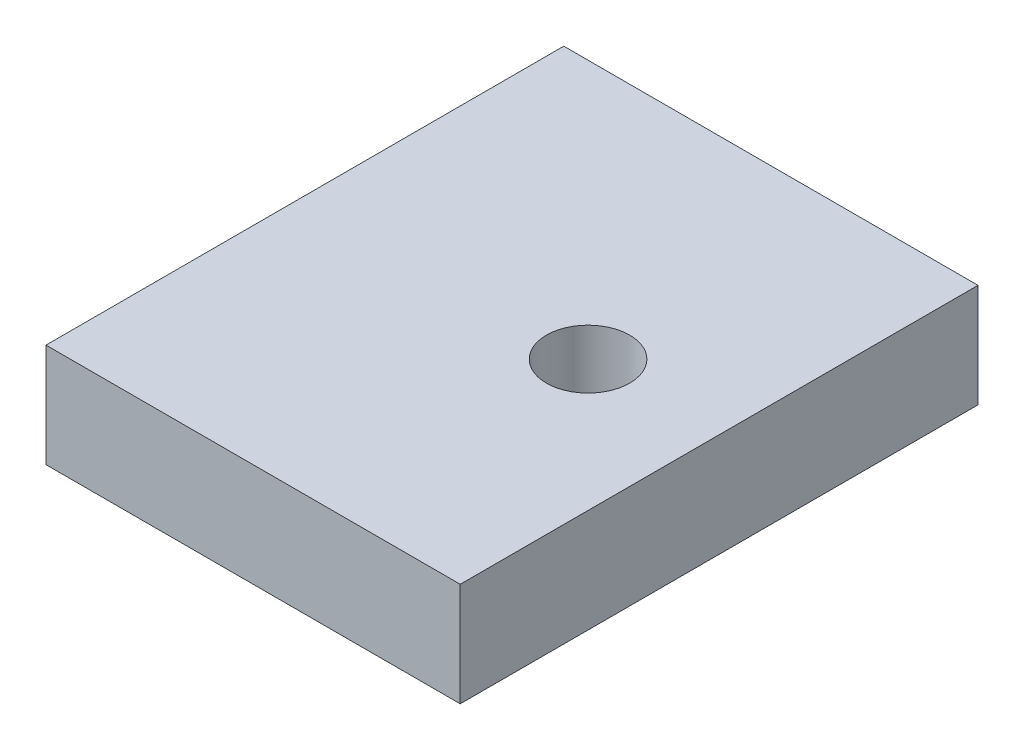
from build123d import *

# Parameters (mm, degrees)
SKETCH2_W                   = 25.4
SKETCH2_H                   = 31.75
BOSS_EXTRUDE1_DEPTH         = 6.35
F_1_4_20_TAPPED_HOLE1_D     = 5.1054
F_1_4_20_TAPPED_HOLE1_DEPTH = 19.05
F_1_4_20_TAPPED_HOLE1_TIP   = 1.533816902


with BuildPart() as part:
    # Sketch2 → Boss-Extrude1 (new body)
    with BuildSketch(Plane(origin=(0, 0, 0), x_dir=(1, 0, 0), z_dir=(0, 1, 0))):
        with Locations((12.7, 15.875)):
            Rectangle(SKETCH2_W, SKETCH2_H)
    extrude(amount=BOSS_EXTRUDE1_DEPTH)

    # 1/4-20 Tapped Hole1
    with Locations(Plane(origin=(17.364456, 6.35, -15.875), x_dir=(0, 0, 1), z_dir=(0, 1, 0))):
        with Locations((0, 0)):
            Hole(F_1_4_20_TAPPED_HOLE1_D / 2, depth=F_1_4_20_TAPPED_HOLE1_DEPTH)
            with Locations((0, 0, -(F_1_4_20_TAPPED_HOLE1_DEPTH + F_1_4_20_TAPPED_HOLE1_TIP / 2))):  # 118° drill point
                Cone(0, F_1_4_20_TAPPED_HOLE1_D / 2, F_1_4_20_TAPPED_HOLE1_TIP, mode=Mode.SUBTRACT)


solid = part.part
